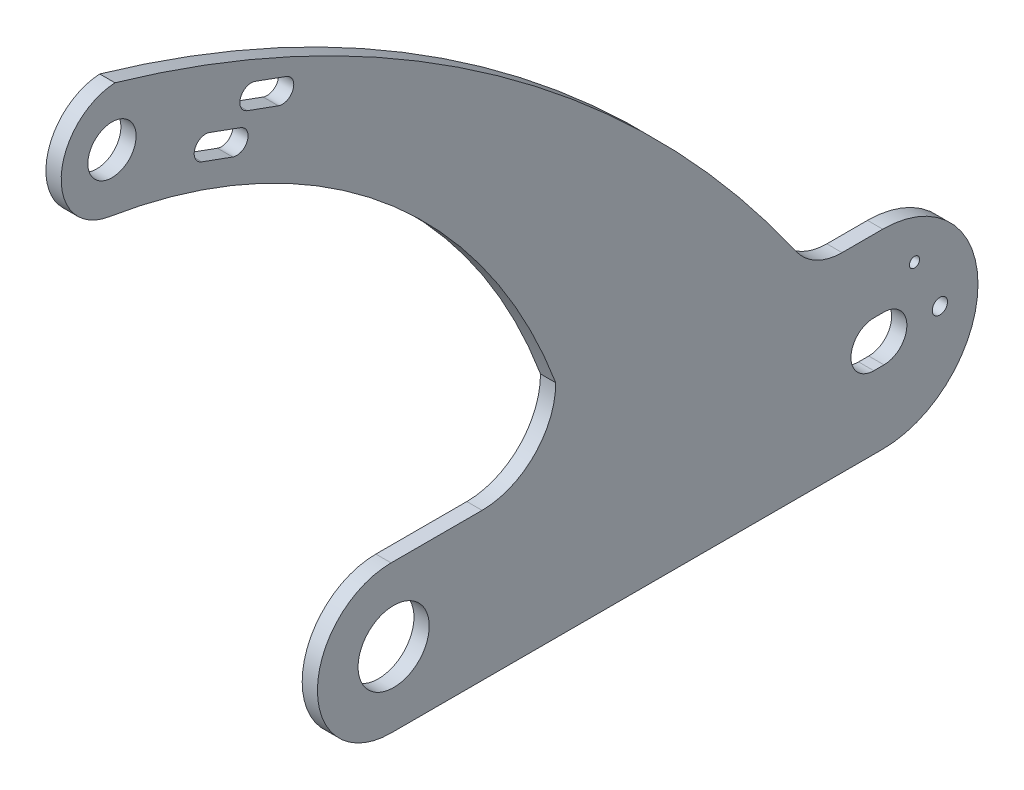
from build123d import *

# Parameters (mm, degrees)
SKETCH1_R           = 1.5
SKETCH1_R_2         = 1
SKETCH1_R_3         = 7
SKETCH1_R_4         = 4.75
BOSS_EXTRUDE1_DEPTH = 3


with BuildPart() as part:
    # Sketch1 → Boss-Extrude1 (new body)
    with BuildSketch(Plane(origin=(0, 0, 0), x_dir=(0, 0, -1), z_dir=(1, 0, 0))):
        with BuildLine():
            Line((-48.375, 0), (48.375, 0))
            ThreePointArc((48.375, 0), (67.125, 18.75), (48.375, 37.5))
            Line((48.375, 37.5), (40.375, 37.5))
            ThreePointArc((40.375, 37.5), (35.295765254, 38.742880835), (31.364327513, 42.1906592))
            ThreePointArc((31.364327513, 42.1906592), (-27.467628368, 101.587088748), (-102.722095146, 138))
            ThreePointArc((-102.722095146, 138), (-113.291936406, 127.38864025), (-103.88918697, 115.730561375))
            ThreePointArc((-103.88918697, 115.730561375), (-50.193524878, 91.468412174), (-15.975, 43.5))
            ThreePointArc((-15.975, 43.5), (-20.221951673, 33.246951673), (-30.475, 29))
            Line((-30.475, 29), (-48.375, 29))
            ThreePointArc((-48.375, 29), (-62.875, 14.5), (-48.375, 0))
        make_face()
        with Locations((59.625, 18.75)):
            Circle(SKETCH1_R, mode=Mode.SUBTRACT)
        with Locations((54.625, 28.75)):
            Circle(SKETCH1_R_2, mode=Mode.SUBTRACT)
        with Locations((-47.875, 14.5)):
            Circle(SKETCH1_R_3, mode=Mode.SUBTRACT)
        with Locations((-103.305641058, 126.865280687)):
            Circle(SKETCH1_R_4, mode=Mode.SUBTRACT)
        with BuildLine():
            Line((46.625, 23.25), (48.625, 23.25))
            ThreePointArc((48.625, 23.25), (53.125, 18.75), (48.625, 14.25))
            Line((48.625, 14.25), (46.625, 14.25))
            ThreePointArc((46.625, 14.25), (42.125, 18.75), (46.625, 23.25))
        make_face(mode=Mode.SUBTRACT)
        with BuildLine():
            Line((-84.112179989, 120.210043762), (-78.004177954, 117.98691283))
            ThreePointArc((-78.004177954, 117.98691283), (-76.659414879, 115.103059111), (-79.543268599, 113.758296037))
            Line((-79.543268599, 113.758296037), (-85.651270634, 115.981426968))
            ThreePointArc((-85.651270634, 115.981426968), (-86.996033708, 118.865280687), (-84.112179989, 120.210043762))
        make_face(mode=Mode.SUBTRACT)
        with BuildLine():
            Line((-75.120324234, 124.438660555), (-69.012322199, 122.215529624))
            ThreePointArc((-69.012322199, 122.215529624), (-67.667559125, 119.331675904), (-70.551412844, 117.98691283))
            Line((-70.551412844, 117.98691283), (-76.659414879, 120.210043762))
            ThreePointArc((-76.659414879, 120.210043762), (-78.004177954, 123.093897481), (-75.120324234, 124.438660555))
        make_face(mode=Mode.SUBTRACT)
    extrude(amount=BOSS_EXTRUDE1_DEPTH)


solid = part.part
